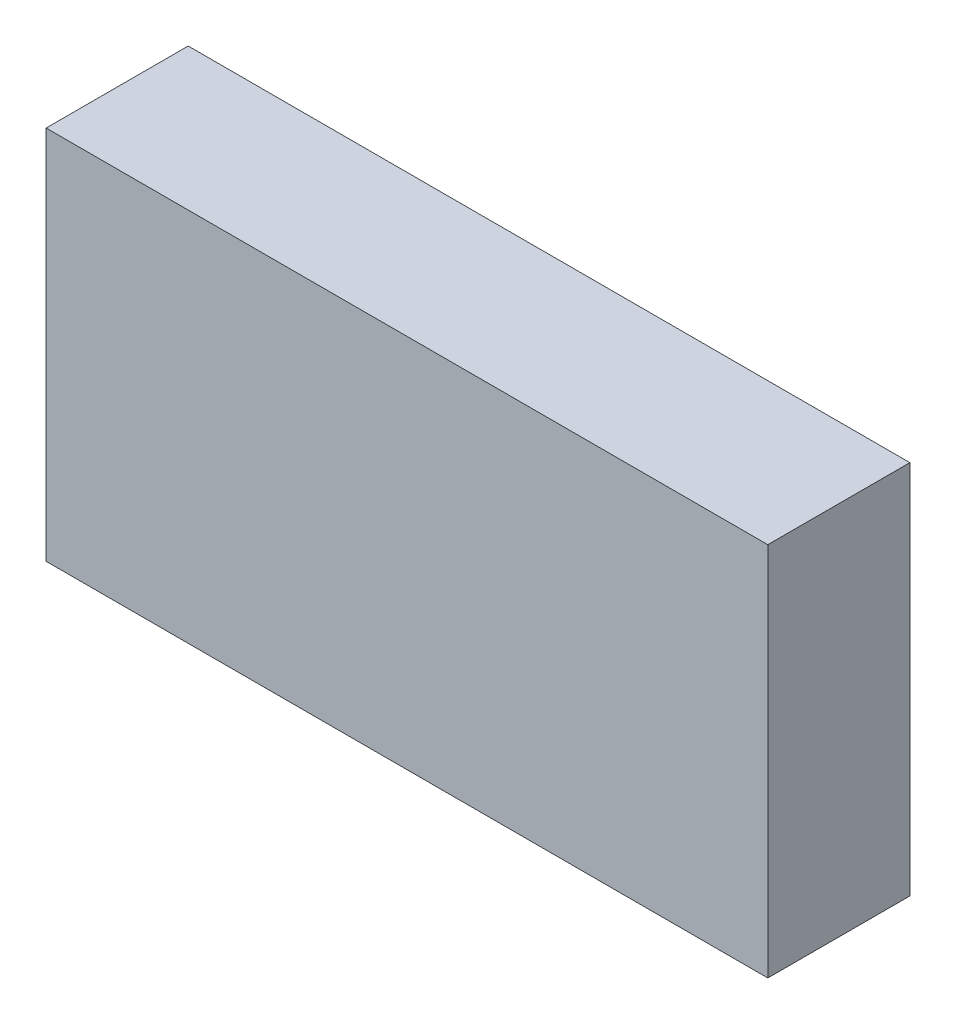
from build123d import *

# Parameters (mm, degrees)
SKETCH1_W               = 5.08
SKETCH1_H               = 2.6416
COMPONENT_OUTLINE_DEPTH = 1


with BuildPart() as part:
    # Sketch1 → Component_Outline (new body)
    with BuildSketch(Plane.XY):
        with Locations((1.27, 0.0508)):
            Rectangle(SKETCH1_W, SKETCH1_H)
    extrude(amount=COMPONENT_OUTLINE_DEPTH)


solid = part.part
